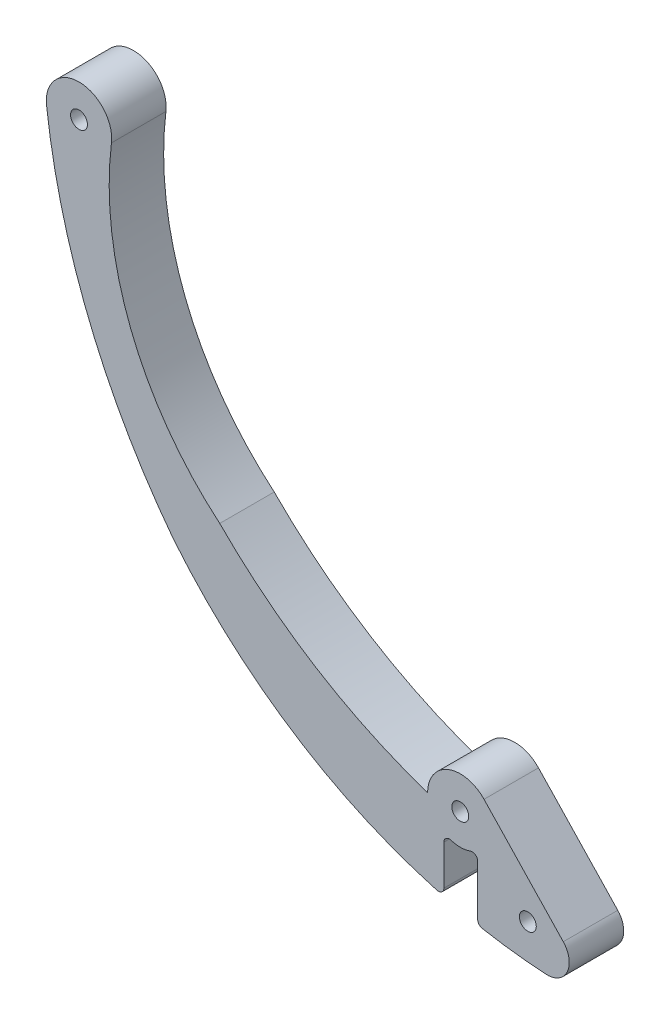
from build123d import *

# Parameters (mm, degrees)
BOSS_EXTRUDE1_DEPTH      = 5
BOSS_EXTRUDE1_DEPTH_BACK = 5
SKETCH2_R                = 1.55
CUT_EXTRUDE1_START       = -10
CUT_EXTRUDE1_DEPTH       = 10
FILLET1_R                = 1


with BuildPart() as part:
    # Sketch2 → Boss-Extrude1 (new, two sides: drawn at the far end of the back side and taken through both)
    with BuildSketch(Plane.XY.offset(-BOSS_EXTRUDE1_DEPTH_BACK)):
        with BuildLine():
            Line((2.905523423, 2.749169627), (-11.641714865, 18.12375444))
            ThreePointArc((-11.641714865, 18.12375444), (-18.21926668, 19.574482524), (-22, 14))
            ThreePointArc((-22, 14), (-42.474078457, 23.622085), (-60.163399658, 37.723869421))
            ThreePointArc((-60.163399658, 37.723869421), (-76.495910352, 60.486816081), (-80.043672644, 88.277390543))
            ThreePointArc((-80.043672644, 88.277390543), (-85.99568578, 94.999998449), (-91.957360362, 88.285956923))
            ThreePointArc((-91.957360362, 88.285956923), (-84.145355247, 58.049091263), (-68.630234445, 30.946019566))
            ThreePointArc((-68.630234445, 30.946019566), (-38.101001964, 6.292742427), (-0.232587209, -3.993232173))
            ThreePointArc((-0.232587209, -3.993232173), (3.626450401, -1.687855885), (2.905523423, 2.749169627))
        make_face()
        with Locations((-86, 89)):
            Circle(SKETCH2_R, mode=Mode.SUBTRACT)
        with Locations((-16, 14)):
            Circle(SKETCH2_R, mode=Mode.SUBTRACT)
        with Locations((-3.6022, 2.7054)):
            Circle(SKETCH2_R, mode=Mode.SUBTRACT)
    extrude(amount=BOSS_EXTRUDE1_DEPTH + BOSS_EXTRUDE1_DEPTH_BACK)

    # Sketch3 → Cut-Extrude1 (cut)
    with BuildSketch(Plane.XY.offset(5).offset(CUT_EXTRUDE1_START)):
        with BuildLine():
            Line((-19.012966708, -1.001561409), (-19.012966708, 9.18151319))
            ThreePointArc((-19.012966708, 9.18151319), (-15.891446961, 8.318098931), (-12.805184231, 9.300113222))
            Line((-12.805184231, 9.300113222), (-12.805184231, -2.418437298))
            ThreePointArc((-12.805184231, -2.418437298), (-15.920894449, -1.76178205), (-19.012966708, -1.001561409))
        make_face()
    extrude(amount=CUT_EXTRUDE1_DEPTH, mode=Mode.SUBTRACT)

    # Fillet1
    fillet1_edges = [part.edges().sort_by_distance(p)[0] for p in [
        (-12.805184231, -2.418437298, 0),
        (-19.012966708, -1.001561409, 0),
        (-19.012966708, 9.18151319, 0),
        (-12.805184231, 9.300113222, 0),
    ]]
    fillet(fillet1_edges, radius=FILLET1_R)


solid = part.part
